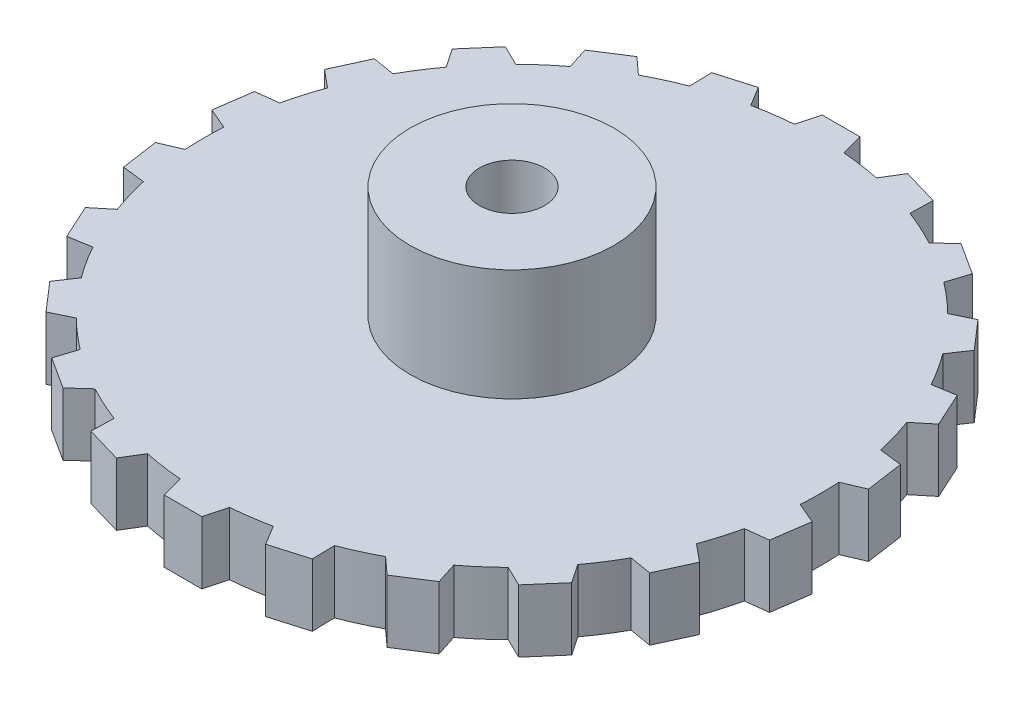
from build123d import *

# Parameters (mm, degrees)
SKETCH1_R           = 29.5
BOSS_EXTRUDE3_DEPTH = 6
BOSS_EXTRUDE2_DEPTH = 6
CIRPATTERN3_COUNT   = 22
SKETCH5_R           = 9.75
BOSS_EXTRUDE4_DEPTH = 10.7
SKETCH6_R           = 3.125
CUT_EXTRUDE1_DEPTH  = 48.532444802


with BuildPart() as part:
    # Sketch1 → Boss-Extrude3 (new body)
    with BuildSketch(Plane(origin=(0, 0, 0), x_dir=(1, 0, 0), z_dir=(0, 1, 0))):
        with Locations(Location((0, 0, 0), (0, 0, 270))):
            Circle(SKETCH1_R)
    extrude(amount=BOSS_EXTRUDE3_DEPTH)

    # Sketch2 → Boss-Extrude2 (add)
    with BuildSketch(Plane(origin=(0, 6, 0), x_dir=(1, 0, 0), z_dir=(0, 1, 0))):
        Polygon((0, 31.5), (1.8, 31.5), (3.407695155, 25.5), (0, 25.5), (-3.407695155, 25.5), (-1.8, 31.5), align=None)
    boss_extrude2 = extrude(amount=-BOSS_EXTRUDE2_DEPTH)

    # CirPattern3: Boss-Extrude2 ×22 about axis
    cirpattern3_axis = Axis((0, 0, 0), (0, 1, 0))
    for i in range(1, CIRPATTERN3_COUNT):
        add(boss_extrude2.rotate(cirpattern3_axis, i * 360 / CIRPATTERN3_COUNT))

    # Sketch5 → Boss-Extrude4 (add)
    with BuildSketch(Plane(origin=(0, 6, 0), x_dir=(1, 0, 0), z_dir=(0, 1, 0))):
        with Locations(Location((0, 0, 0), (0, 0, 270))):
            Circle(SKETCH5_R)
    extrude(amount=BOSS_EXTRUDE4_DEPTH)

    # Sketch6 → Cut-Extrude1 (cut, through all)
    with BuildSketch(Plane(origin=(0, 16.7, 0), x_dir=(1, 0, 0), z_dir=(0, 1, 0))):
        with Locations(Location((0, 0, 0), (0, 0, 270))):
            Circle(SKETCH6_R)
    extrude(amount=-CUT_EXTRUDE1_DEPTH, mode=Mode.SUBTRACT)


solid = part.part
